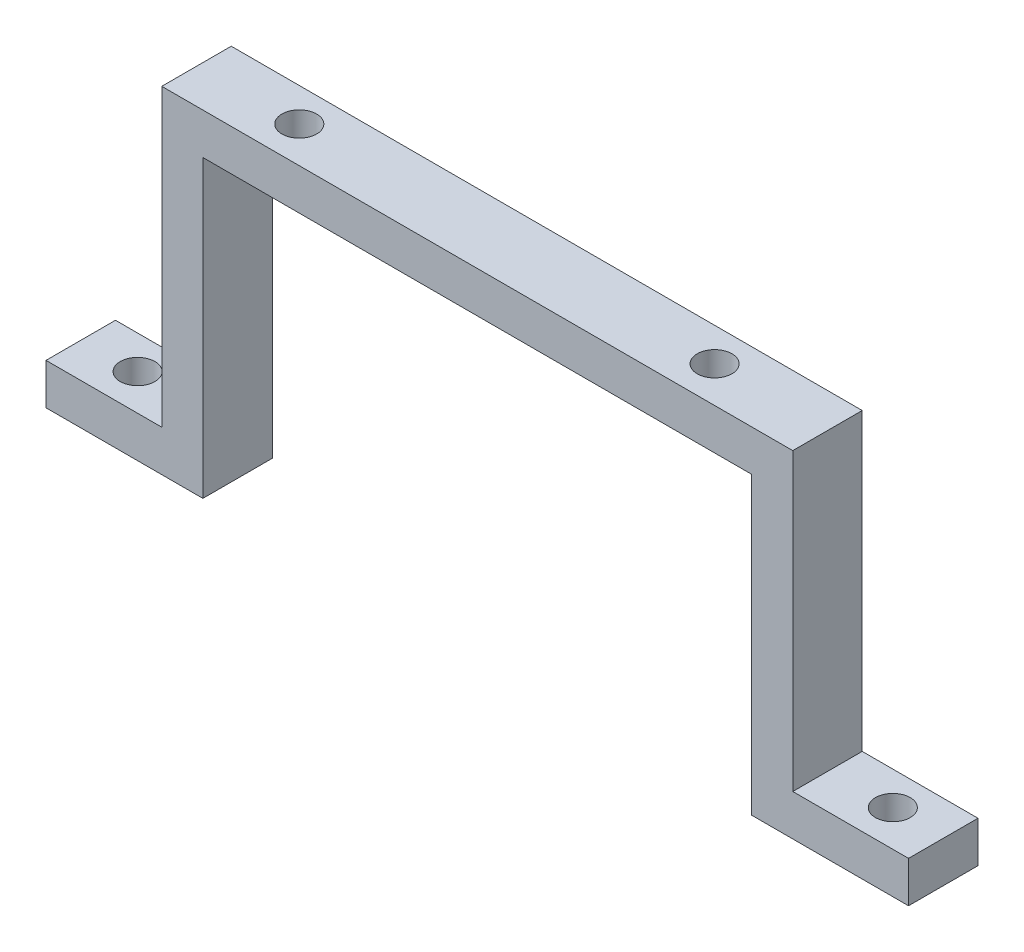
from build123d import *

# Parameters (mm, degrees)
EXTRUDE_THIN4_DEPTH     = 6
CUT_EXTRUDE1_DEPTH      = 41
CUT_EXTRUDE1_DEPTH_BACK = 28
SKETCH3_R               = 1.5


with BuildPart() as part:
    # Sketch1 → Extrude-Thin4 (new body)
    with BuildSketch(Plane.XY):
        Polygon((-12.432700034, 0), (-2.432700034, 0), (-2.432700034, 25.5), (52.067299966, 25.5), (52.067299966, 0), (62.067299966, 0), (62.067299966, -3.550080031), (48.517219935, -3.550080031), (48.517219935, 21.949919969), (1.117379996, 21.949919969), (1.117379996, -3.550080031), (-12.432700034, -3.550080031), align=None)
    extrude(amount=EXTRUDE_THIN4_DEPTH)

    # Sketch3 → Cut-Extrude1 (cut, two sides: drawn at the far end of the back side and taken through both)
    with BuildSketch(Plane(origin=(0, 0, 0), x_dir=(1, 0, 0), z_dir=(0, 1, 0)).offset(-CUT_EXTRUDE1_DEPTH_BACK)):
        with Locations(Location((-7.639613875, -2.880964864, 0), (0, 0, 270))):
            Circle(SKETCH3_R)
        with Locations(Location((6.327175455, -2.880964864, 0), (0, 0, 270))):
            Circle(SKETCH3_R)
        with Locations(Location((42.196429871, -2.880964864, 0), (0, 0, 270))):
            Circle(SKETCH3_R)
        with Locations(Location((57.591640837, -2.880964864, 0), (0, 0, 180))):
            Circle(SKETCH3_R)
    extrude(amount=CUT_EXTRUDE1_DEPTH + CUT_EXTRUDE1_DEPTH_BACK, mode=Mode.SUBTRACT)


solid = part.part
